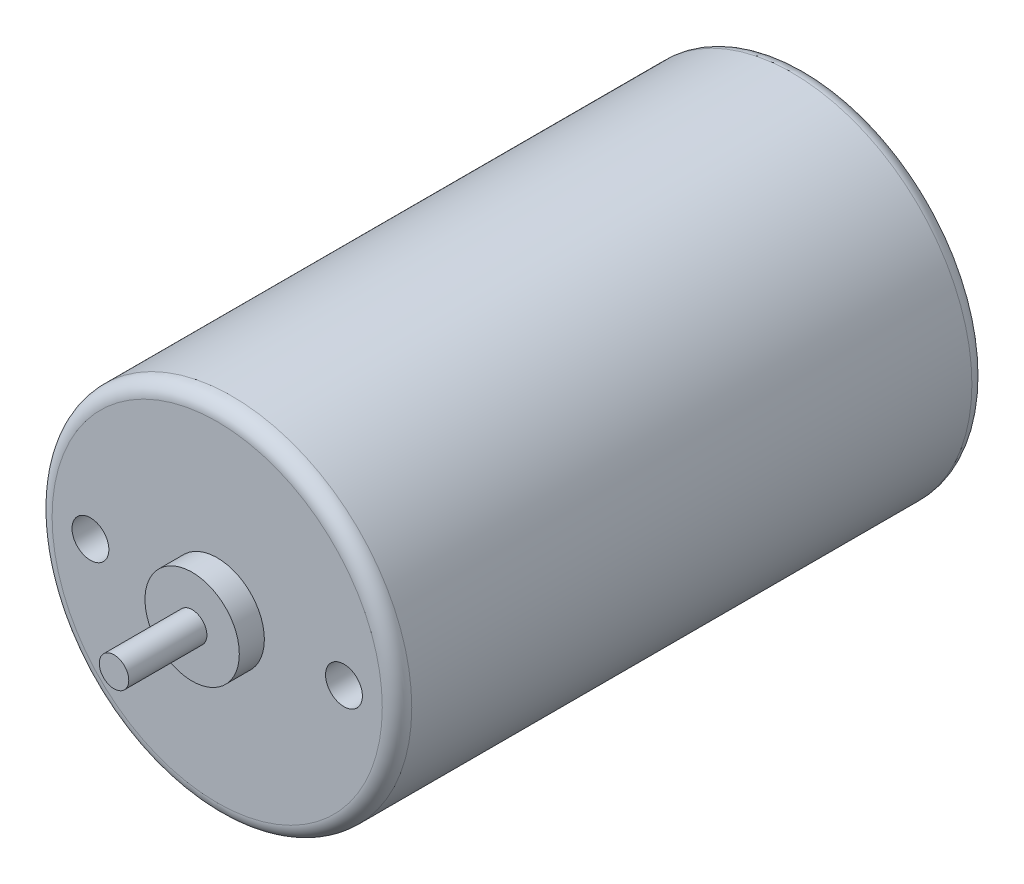
from build123d import *

# Parameters (mm, degrees)
ESBO_O1_R                                   = 12.2
RESSALTO_EXTRUS_O1_DEPTH                    = 40
ESBO_O2_R                                   = 3.2
RESSALTO_EXTRUS_O2_DEPTH                    = 1.7
ESBO_O3_R                                   = 1
RESSALTO_EXTRUS_O3_DEPTH                    = 5.3
BROCA_DE_ROSQUEAR_PARA_TARRAXA_DE_M31_D     = 2.5
BROCA_DE_ROSQUEAR_PARA_TARRAXA_DE_M31_DEPTH = 4
BROCA_DE_ROSQUEAR_PARA_TARRAXA_DE_M31_TIP   = 0.751075774
FILETE1_R                                   = 1
FILETE2_R                                   = 1


with BuildPart() as part:
    # Esboço1 → Ressalto-extrusão1 (new body)
    with BuildSketch(Plane.XY):
        Circle(ESBO_O1_R)
    extrude(amount=RESSALTO_EXTRUS_O1_DEPTH)

    # Esboço2 → Ressalto-extrusão2 (add)
    with BuildSketch(Plane.XY.offset(40)):
        Circle(ESBO_O2_R)
    extrude(amount=RESSALTO_EXTRUS_O2_DEPTH)

    # Esboço3 → Ressalto-extrusão3 (add)
    with BuildSketch(Plane.XY.offset(41.7)):
        Circle(ESBO_O3_R)
    extrude(amount=RESSALTO_EXTRUS_O3_DEPTH)

    # Broca de rosquear para tarraxa de M31
    with Locations(Plane(origin=(-8.6, 0, 40), x_dir=(1, 0, 0), z_dir=(0, 0, 1))):
        with Locations((0, 0), (17.2, 0)):
            Hole(BROCA_DE_ROSQUEAR_PARA_TARRAXA_DE_M31_D / 2, depth=BROCA_DE_ROSQUEAR_PARA_TARRAXA_DE_M31_DEPTH)
            with Locations((0, 0, -(BROCA_DE_ROSQUEAR_PARA_TARRAXA_DE_M31_DEPTH + BROCA_DE_ROSQUEAR_PARA_TARRAXA_DE_M31_TIP / 2))):  # 118° drill point
                Cone(0, BROCA_DE_ROSQUEAR_PARA_TARRAXA_DE_M31_D / 2, BROCA_DE_ROSQUEAR_PARA_TARRAXA_DE_M31_TIP, mode=Mode.SUBTRACT)

    # Filete1
    filete1_edges = [part.edges().sort_by_distance(p)[0] for p in [
        (-12.2, 0, 40),
    ]]
    fillet(filete1_edges, radius=FILETE1_R)

    # Filete2
    filete2_edges = [part.edges().sort_by_distance(p)[0] for p in [
        (-12.2, 0, 0),
    ]]
    fillet(filete2_edges, radius=FILETE2_R)


solid = part.part
